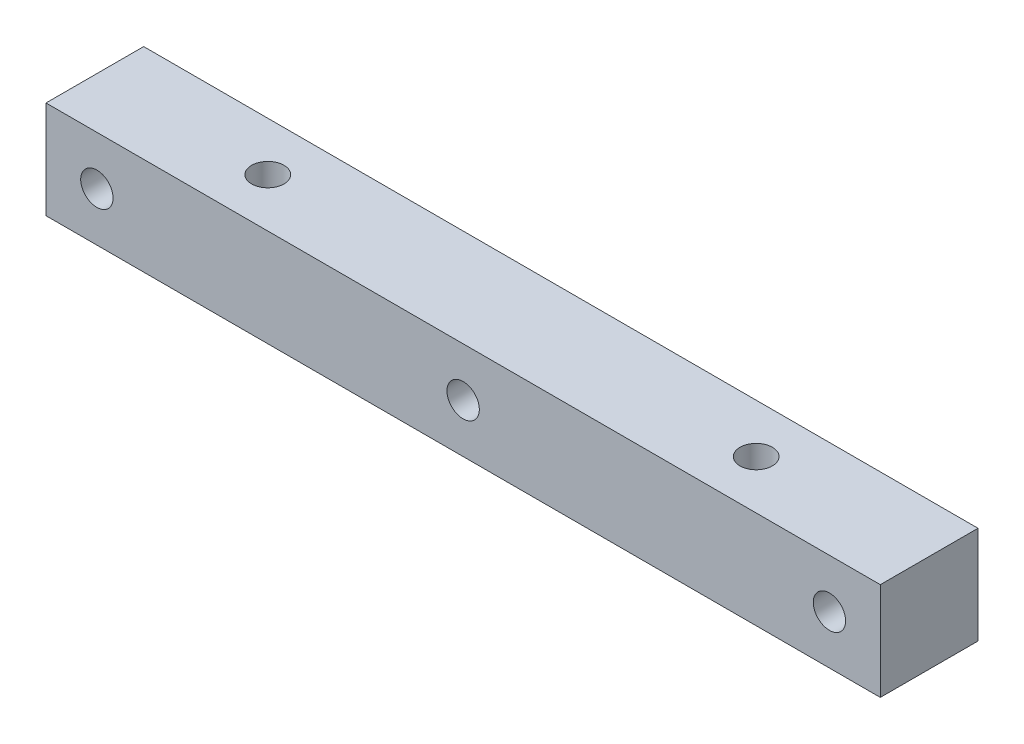
from build123d import *

# Parameters (mm, degrees)
SKETCH1_W                  = 12.192
SKETCH1_H                  = 12.192
BOSS_EXTRUDE1_DEPTH        = 52.07
TAP_DRILL_FOR_10_32_TAP1_D = 4.0386
TAP_DRILL_FOR_10_32_TAP2_D = 4.0386


with BuildPart() as part:
    # Sketch1 → Boss-Extrude1 (new, symmetric)
    with BuildSketch(Plane(origin=(0, 0, 0), x_dir=(0, -1, 0), z_dir=(1, 0, 0))):
        Rectangle(SKETCH1_W, SKETCH1_H)
    extrude(amount=BOSS_EXTRUDE1_DEPTH, both=True)

    # Tap Drill for #10-32 Tap1 (through all)
    with Locations(Plane.XY.offset(6.096)):
        with Locations((-45.72, 0), (45.72, 0), (0, 0)):
            Hole(TAP_DRILL_FOR_10_32_TAP1_D / 2)

    # Tap Drill for #10-32 Tap2 (through all)
    with Locations(Plane(origin=(0, 6.096, 0), x_dir=(1, 0, 0), z_dir=(0, 1, 0))):
        with Locations((-30.48, 0), (30.48, 0)):
            Hole(TAP_DRILL_FOR_10_32_TAP2_D / 2)


solid = part.part
